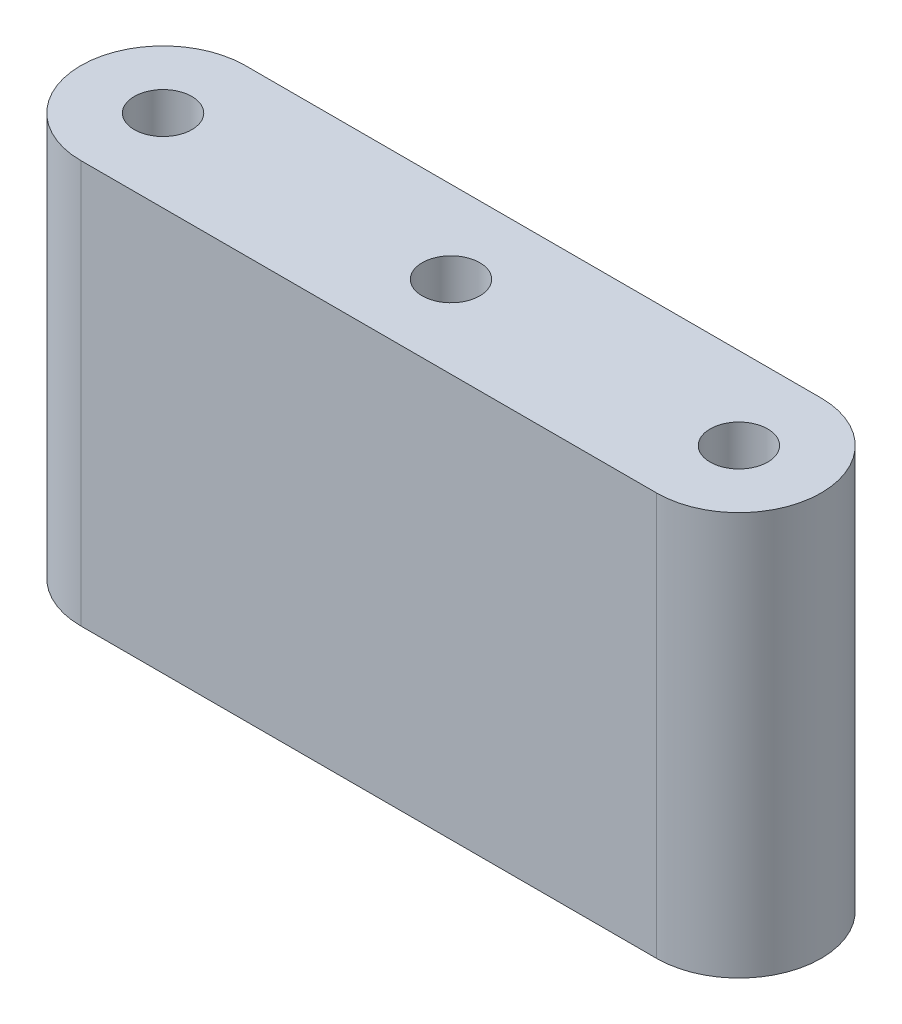
from build123d import *

# Parameters (mm, degrees)
SKETCH1_R           = 6.75
BOSS_EXTRUDE1_DEPTH = 6
SKETCH2_R           = 3.5
BOSS_EXTRUDE2_DEPTH = 43


with BuildPart() as part:
    # Sketch1 → Boss-Extrude1 (new body)
    with BuildSketch(Plane(origin=(0, 0, 0), x_dir=(1, 0, 0), z_dir=(0, 1, 0))):
        with BuildLine():
            Line((-35, 10), (35, 10))
            ThreePointArc((35, 10), (45, 0), (35, -10))
            Line((35, -10), (-35, -10))
            ThreePointArc((-35, -10), (-45, 0), (-35, 10))
        make_face()
        with Locations(Location((0, 0, 0), (0, 0, 270))):
            Circle(SKETCH1_R, mode=Mode.SUBTRACT)
        with Locations(Location((35, 0, 0), (0, 0, 270))):
            Circle(SKETCH1_R, mode=Mode.SUBTRACT)
        with Locations(Location((-35, 0, 0), (0, 0, 270))):
            Circle(SKETCH1_R, mode=Mode.SUBTRACT)
    extrude(amount=BOSS_EXTRUDE1_DEPTH)

    # Sketch2 → Boss-Extrude2 (add)
    with BuildSketch(Plane(origin=(0, 6, 0), x_dir=(1, 0, 0), z_dir=(0, 1, 0))):
        with BuildLine():
            Line((-35, -10), (35, -10))
            ThreePointArc((35, -10), (45, 0), (35, 10))
            Line((35, 10), (-35, 10))
            ThreePointArc((-35, 10), (-45, 0), (-35, -10))
        make_face()
        with Locations(Location((-35, 0, 0), (0, 0, 270))):
            Circle(SKETCH2_R, mode=Mode.SUBTRACT)
        with Locations(Location((0, 0, 0), (0, 0, 270))):
            Circle(SKETCH2_R, mode=Mode.SUBTRACT)
        with Locations(Location((35, 0, 0), (0, 0, 270))):
            Circle(SKETCH2_R, mode=Mode.SUBTRACT)
    extrude(amount=BOSS_EXTRUDE2_DEPTH)


solid = part.part
